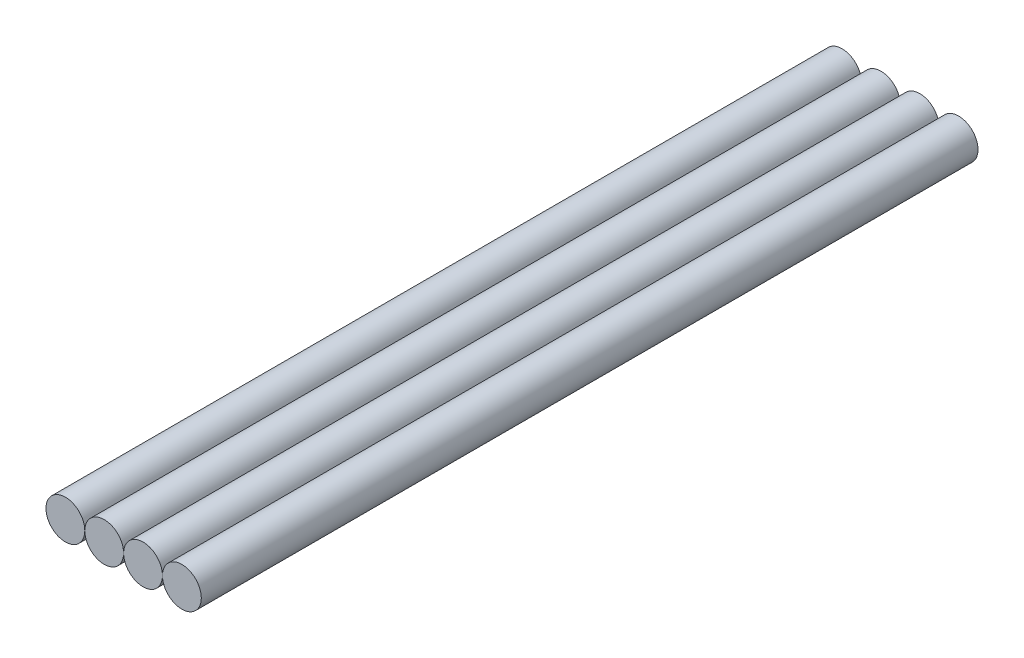
from build123d import *

# Parameters (mm, degrees)
ESQUISSE1_R                  = 0.5
BOSS_EXTRU_1_DEPTH           = 10
R_P_TITION_LIN_AIRE1_COUNT   = 3
R_P_TITION_LIN_AIRE1_PITCH   = 1
R_P_TITION_LIN_AIRE1_2_COUNT = 2
R_P_TITION_LIN_AIRE1_2_PITCH = 1


with BuildPart() as part:
    # Esquisse1 → Boss.-Extru.1 (new, symmetric)
    with BuildSketch(Plane.XY.offset(35)):
        with Locations((4.263994142, -7.634270778)):
            Circle(ESQUISSE1_R)
    extrude(amount=BOSS_EXTRU_1_DEPTH, both=True)


with BuildPart() as r_p_tition_lin_aire1_1:
    # Répétition linéaire1: pattern copy
    add(part.part.moved(Location(Vector(1, 0, 0) * (1 * R_P_TITION_LIN_AIRE1_PITCH))))


with BuildPart() as r_p_tition_lin_aire1_2:
    # Répétition linéaire1: pattern copy
    add(part.part.moved(Location(Vector(1, 0, 0) * (2 * R_P_TITION_LIN_AIRE1_PITCH))))


with BuildPart() as r_p_tition_lin_aire1_2_1:
    # R_p_tition lin_aire1 2: pattern copy
    add(part.part.moved(Location(Vector(-1, 0, 0) * (1 * R_P_TITION_LIN_AIRE1_2_PITCH))))


solid = Compound([part.part, r_p_tition_lin_aire1_1.part, r_p_tition_lin_aire1_2.part, r_p_tition_lin_aire1_2_1.part])
